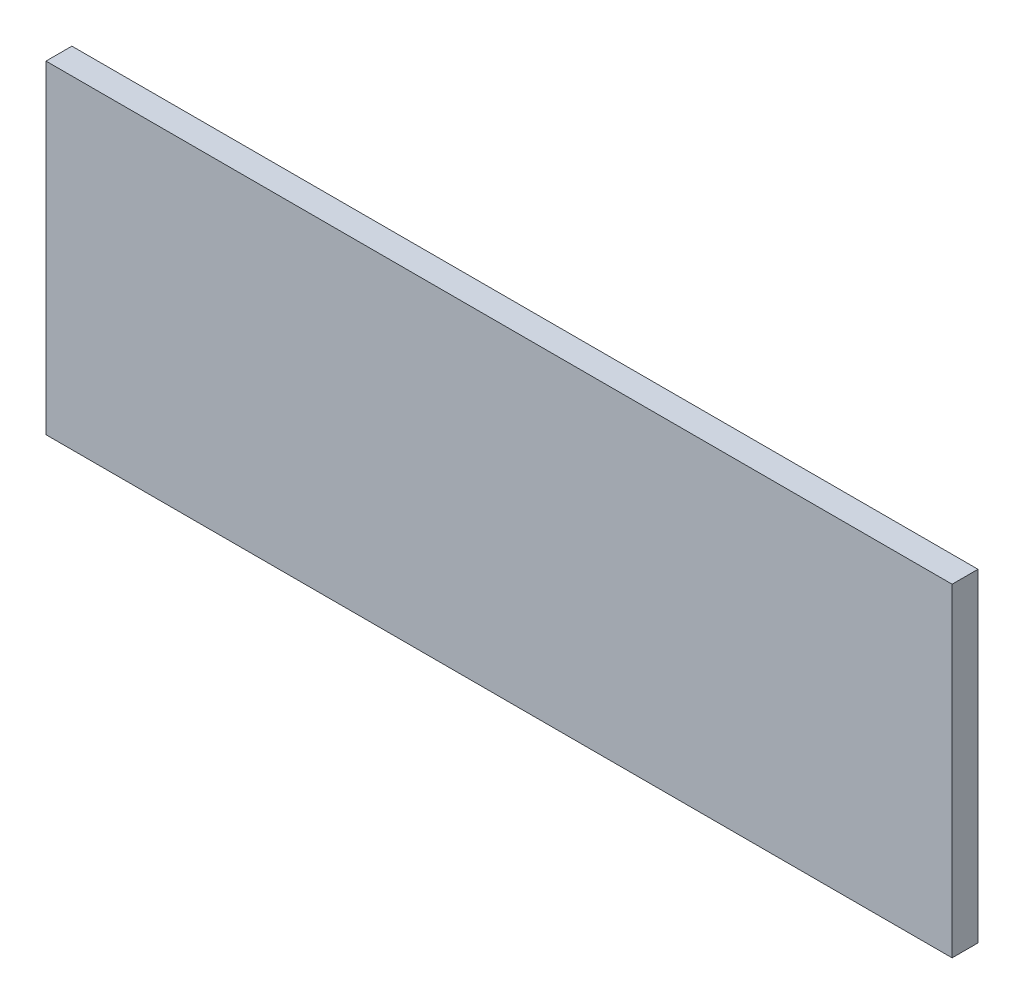
from build123d import *

# Parameters (mm, degrees)
SKETCH_1_W        = 700
SKETCH_1_H        = 250
EXTRUDE_569_DEPTH = 20


with BuildPart() as part:
    # 草图1 → Extrude 569 (new body)
    with BuildSketch(Plane.XY):
        Rectangle(SKETCH_1_W, SKETCH_1_H)
    extrude(amount=EXTRUDE_569_DEPTH)


solid = part.part
